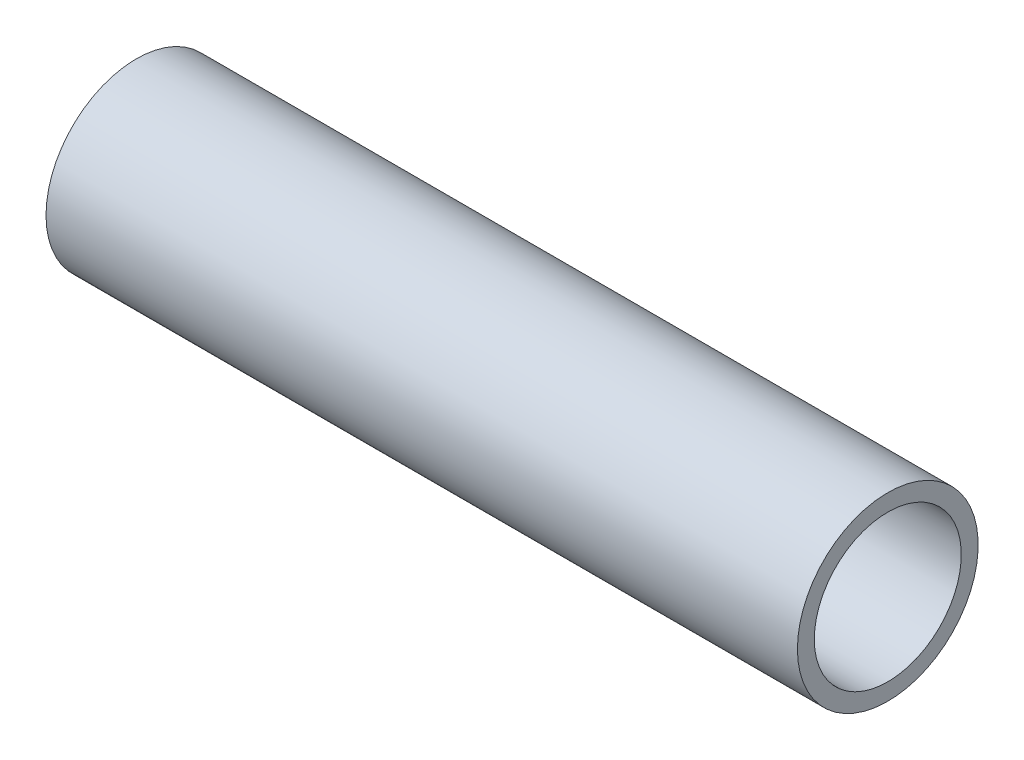
from build123d import *

# Parameters (mm, degrees)
TUBE_T6_STUB_SKETCH_W = 39.6
TUBE_T6_STUB_SKETCH_H = 0.889


with BuildPart() as part:
    # Tube_T6_Stub Sketch → Tube_T6_Stub (revolve)
    with BuildSketch(Plane.XY):
        with Locations((0, 4.318)):
            Rectangle(TUBE_T6_STUB_SKETCH_W, TUBE_T6_STUB_SKETCH_H)
    revolve(axis=Axis((-1000, 0, 0), (1, 0, 0)))


solid = part.part
